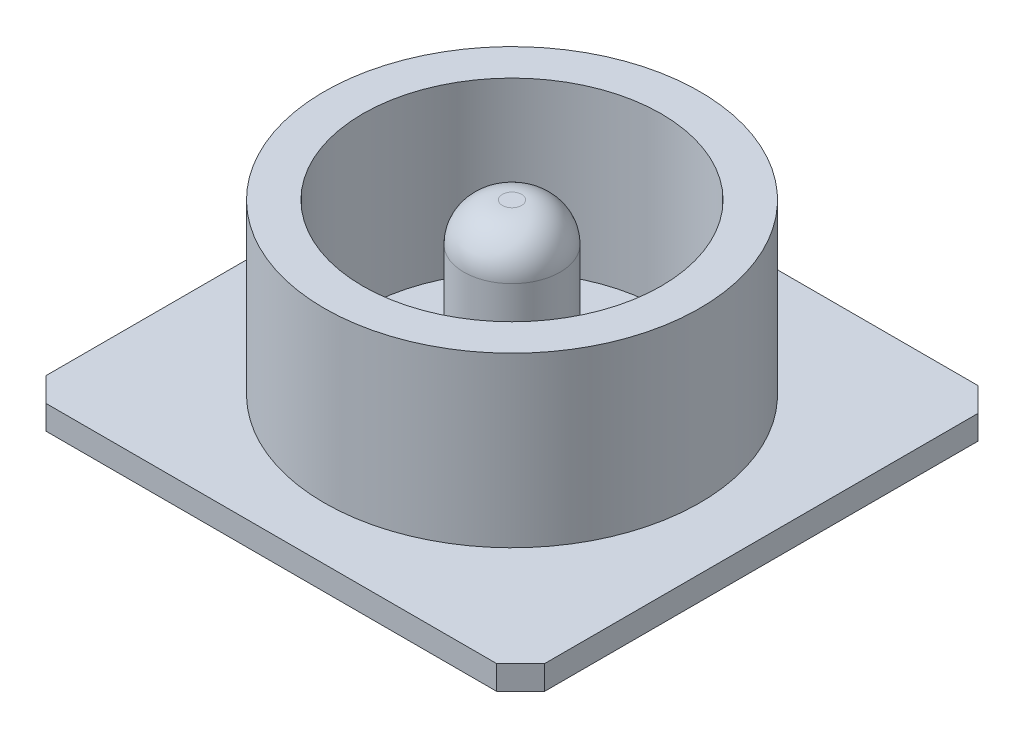
from build123d import *

# Parameters (mm, degrees)
SKETCH1_W           = 2.631072102
SKETCH1_H           = 2.54
BOSS_EXTRUDE1_DEPTH = 0.127
SKETCH2_R           = 0.9906
BOSS_EXTRUDE2_DEPTH = 0.889
HOLE1_D             = 1.5748
SKETCH5_W           = 0.254
SKETCH5_H           = 0.889
CHAMFER1_SIZE       = 0.127
FILLET1_R           = 0.2032
SKETCH6_R           = 0.7874
BOSS_EXTRUDE3_DEPTH = 0.127


with BuildPart() as part:
    # Sketch1 → Boss-Extrude1 (new body)
    with BuildSketch(Plane(origin=(0, 0, 0), x_dir=(1, 0, 0), z_dir=(0, 1, 0))):
        Rectangle(SKETCH1_W, SKETCH1_H)
    extrude(amount=-BOSS_EXTRUDE1_DEPTH)

    # Sketch2 → Boss-Extrude2 (add)
    with BuildSketch(Plane(origin=(0, 0, 0), x_dir=(-1, 0, 0), z_dir=(0, 1, 0))):
        with Locations(Location((0, 0, 0), (0, 0, 90))):
            Circle(SKETCH2_R)
    extrude(amount=BOSS_EXTRUDE2_DEPTH)

    # Hole1 (through all)
    with Locations(Plane(origin=(0, 0.889, 0), x_dir=(-1, 0, 0), z_dir=(0, 1, 0))):
        with Locations((0, 0)):
            Hole(HOLE1_D / 2)

    # Chamfer1
    chamfer1_edges = [part.edges().sort_by_distance(p)[0] for p in [
        (-1.315536051, -0.0635, 1.27),
        (-1.315536051, -0.0635, -1.27),
        (1.315536051, -0.0635, -1.27),
        (1.315536051, -0.0635, 1.27),
    ]]
    chamfer(chamfer1_edges, length=CHAMFER1_SIZE)



with BuildPart() as body_2:
    # Sketch5 → Revolve1 (revolve)
    with BuildSketch(Plane.XY, mode=Mode.PRIVATE) as revolve1_sk:
        with Locations((0.127, 0.4445)):
            Rectangle(SKETCH5_W, SKETCH5_H)
    revolve(revolve1_sk.sketch.rotate(Axis((0, 0.889, 0), (0, -1, 0)), 90), axis=Axis((0, 0.889, 0), (0, -1, 0)))

    # Fillet1
    fillet1_edges = [body_2.edges().sort_by_distance(p)[0] for p in [
        (0, 0.889, -0.254),
    ]]
    fillet(fillet1_edges, radius=FILLET1_R)


with BuildPart() as part_1:
    add(part.part)

    add(body_2.part)  # Boss-Extrude3 merges body 2
    # Sketch6 → Boss-Extrude3 (add)
    with BuildSketch(Plane.XZ.offset(0.127)):
        with Locations(Location((0, 0, 0), (0, 0, 90))):
            Circle(SKETCH6_R)
    extrude(amount=-BOSS_EXTRUDE3_DEPTH)


solid = part_1.part
